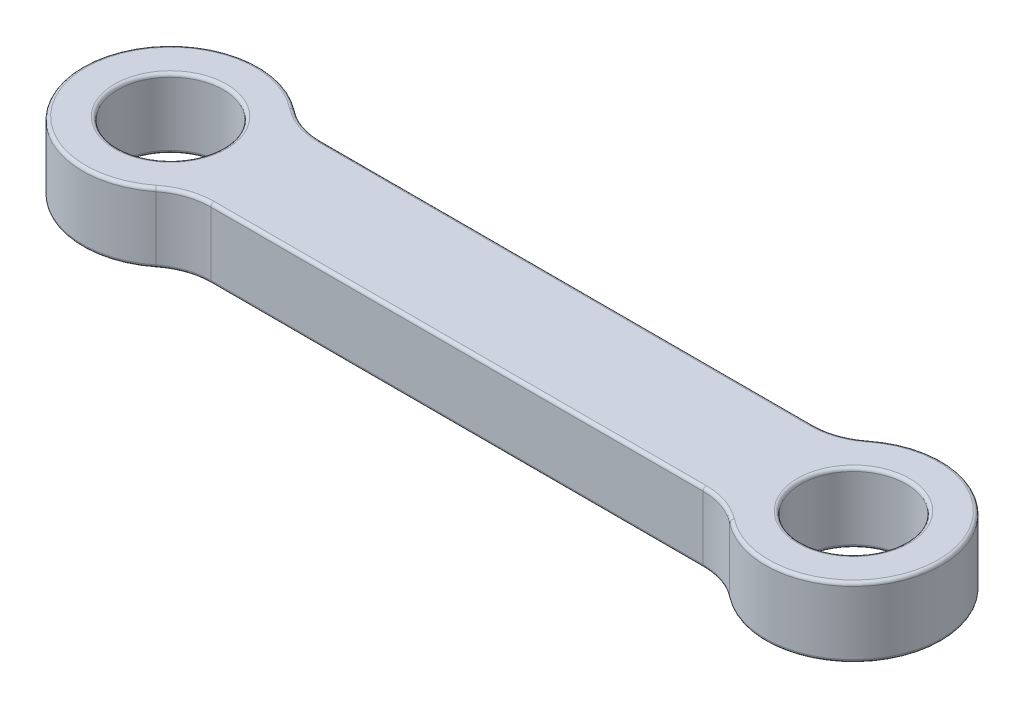
from build123d import *

# Parameters (mm, degrees)
SKETCH1_R           = 4
SKETCH1_R_2         = 2.395
BOSS_EXTRUDE1_DEPTH = 3.175
FILLET1_R           = 3
FILLET2_R           = 0.15


with BuildPart() as part:
    # Sketch1 → Boss-Extrude1 (new body)
    # profile 1 of 3: a face of its own
    with BuildSketch(Plane(origin=(0, 0, 0), x_dir=(1, 0, 0), z_dir=(0, 1, 0))):
        with Locations((-15.5, 0)):
            Circle(SKETCH1_R)
        with Locations(Location((-15.5, 0, 0), (0, 0, 270))):
            Circle(SKETCH1_R_2, mode=Mode.SUBTRACT)
    # profile 2 of 3: a face of its own
    with BuildSketch(Plane(origin=(0, 0, 0), x_dir=(1, 0, 0), z_dir=(0, 1, 0))):
        with BuildLine():
            Line((12.377501001, 2.5), (-12.377501001, 2.5))
            ThreePointArc((-12.377501001, 2.5), (-11.725745372, 1.324764885), (-11.5, 0))
            ThreePointArc((-11.5, 0), (-11.725745372, -1.324764885), (-12.377501001, -2.5))
            Line((-12.377501001, -2.5), (12.377501001, -2.5))
            ThreePointArc((12.377501001, -2.5), (11.5, 0), (12.377501001, 2.5))
        make_face()
    # profile 3 of 3: a face of its own
    with BuildSketch(Plane(origin=(0, 0, 0), x_dir=(1, 0, 0), z_dir=(0, 1, 0))):
        with Locations((15.5, 0)):
            Circle(SKETCH1_R)
        with Locations(Location((15.5, 0, 0), (0, 0, 270))):
            Circle(SKETCH1_R_2, mode=Mode.SUBTRACT)
    extrude(amount=BOSS_EXTRUDE1_DEPTH)

    # Fillet1
    fillet1_edges = [part.edges().sort_by_distance(p)[0] for p in [
        (-12.377501001, 1.5875, -2.5),
        (12.377501001, 1.5875, -2.5),
        (12.377501001, 1.5875, 2.5),
        (-12.377501001, 1.5875, 2.5),
    ]]
    fillet(fillet1_edges, radius=FILLET1_R)

    # Fillet2
    fillet2_edges = [part.edges().sort_by_distance(p)[0] for p in [
        (-15.5, 0, -2.395),
        (-19.5, 0, 0),
        (-19.5, 3.175, 0),
        (0, 0, -2.5),
        (0, 3.175, -2.5),
        (19.5, 0, 0),
        (19.5, 3.175, 0),
        (0, 0, 2.5),
        (0, 3.175, 2.5),
        (-12.151853487, 0, -2.665266452),
        (15.5, 3.175, -2.395),
        (-12.151853487, 3.175, -2.665266452),
        (12.151853487, 0, -2.665266452),
        (12.151853487, 3.175, -2.665266452),
        (12.151853487, 0, 2.665266452),
        (12.151853487, 3.175, 2.665266452),
        (-12.151853487, 0, 2.665266452),
        (-12.151853487, 3.175, 2.665266452),
        (-15.5, 3.175, -2.395),
        (15.5, 0, -2.395),
    ]]
    fillet(fillet2_edges, radius=FILLET2_R)


solid = part.part
